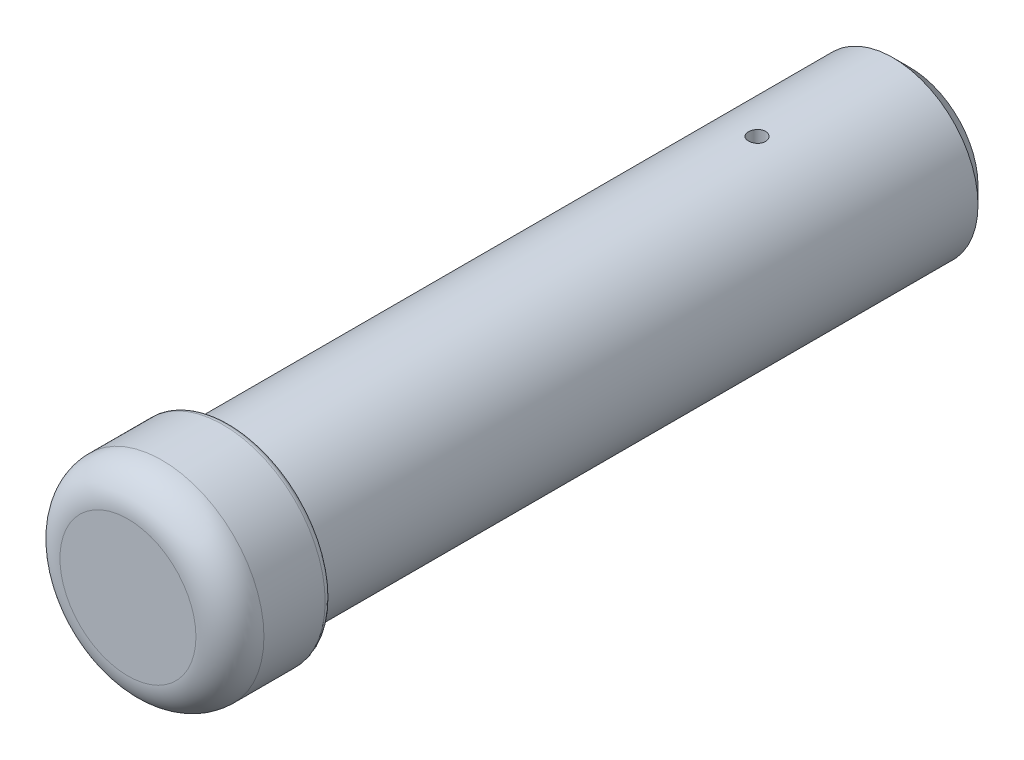
from build123d import *

# Parameters (mm, degrees)
SKETCH1_R               = 25
BOSS_EXTRUDE1_DEPTH     = 200
SKETCH2_R               = 30
BOSS_EXTRUDE2_DEPTH     = 30
FILLET1_R               = 10
FILLET2_R               = 2
CHAMFER1_SIZE           = 5
CUT_EXTRUDE1_DEPTH      = 234.880311271
CUT_EXTRUDE1_DEPTH_BACK = 234.880311271
SKETCH3_R               = 2.5


with BuildPart() as part:
    # Sketch1 → Boss-Extrude1 (new body)
    with BuildSketch(Plane.XY):
        Circle(SKETCH1_R)
    extrude(amount=BOSS_EXTRUDE1_DEPTH)

    # Sketch2 → Boss-Extrude2 (add)
    with BuildSketch(Plane.XY.offset(200)):
        Circle(SKETCH2_R)
    extrude(amount=BOSS_EXTRUDE2_DEPTH)

    # Fillet1
    fillet1_edges = [part.edges().sort_by_distance(p)[0] for p in [
        (-30, 0, 230),
    ]]
    fillet(fillet1_edges, radius=FILLET1_R)

    # Fillet2
    fillet2_edges = [part.edges().sort_by_distance(p)[0] for p in [
        (-25, 0, 200),
        (-30, 0, 200),
    ]]
    fillet(fillet2_edges, radius=FILLET2_R)

    # Chamfer1
    chamfer1_edges = [part.edges().sort_by_distance(p)[0] for p in [
        (-25, 0, 0),
    ]]
    chamfer(chamfer1_edges, length=CHAMFER1_SIZE)

    # Sketch3 → Cut-Extrude1 (cut, two sides: drawn at the far end of the back side and taken through both)
    with BuildSketch(Plane(origin=(0, 0, 0), x_dir=(1, 0, 0), z_dir=(0, 1, 0)).offset(-CUT_EXTRUDE1_DEPTH_BACK)):
        with Locations(Location((0, -45, 0), (0, 0, 270))):
            Circle(SKETCH3_R)
    extrude(amount=CUT_EXTRUDE1_DEPTH + CUT_EXTRUDE1_DEPTH_BACK, mode=Mode.SUBTRACT)


solid = part.part
